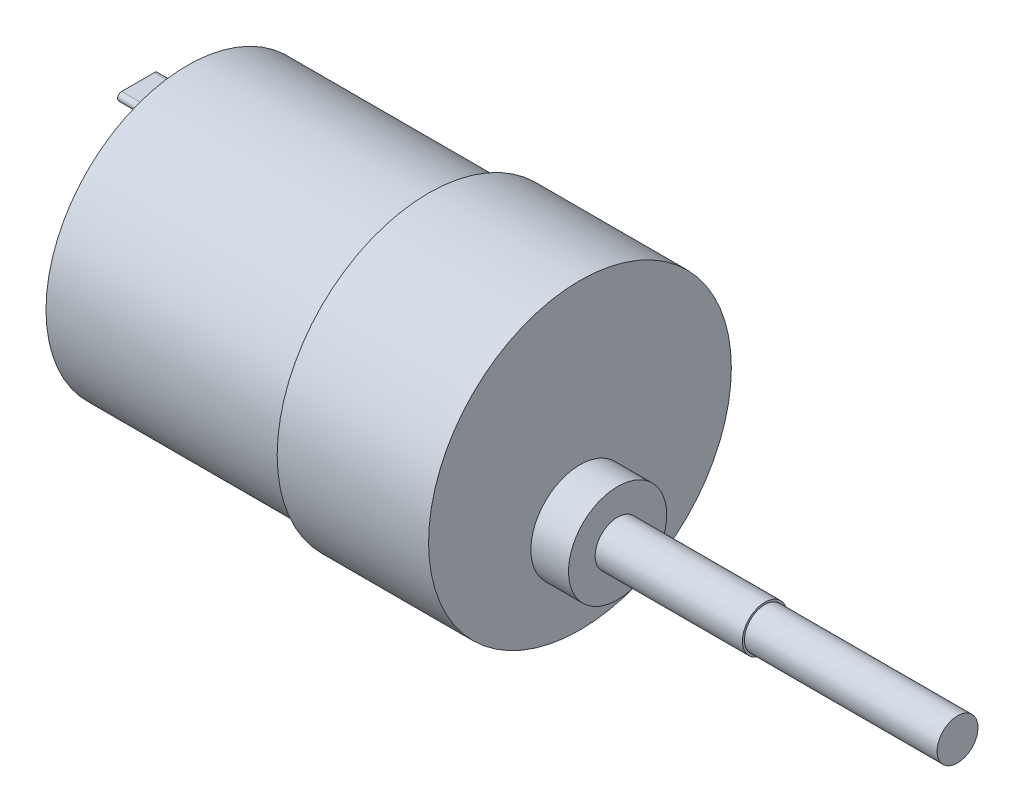
from build123d import *

# Parameters (mm, degrees)
SKETCH1_R           = 17.25
BOSS_EXTRUDE1_DEPTH = 29.5
SKETCH2_R           = 18.5
BOSS_EXTRUDE2_DEPTH = 18.5
SKETCH3_R           = 3
BOSS_EXTRUDE3_DEPTH = 1.5
SKETCH4_R           = 1.5
BOSS_EXTRUDE4_DEPTH = 1.5
BOSS_EXTRUDE5_DEPTH = 6
SKETCH7_R           = 6
BOSS_EXTRUDE6_DEPTH = 4.6
SKETCH8_R           = 2.75
BOSS_EXTRUDE7_DEPTH = 18
SKETCH9_R           = 2.5
BOSS_EXTRUDE8_DEPTH = 23.54


with BuildPart() as part:
    # Sketch1 → Boss-Extrude1 (new body)
    with BuildSketch(Plane(origin=(0, 0, 0), x_dir=(0, 0, -1), z_dir=(1, 0, 0))):
        Circle(SKETCH1_R)
    extrude(amount=BOSS_EXTRUDE1_DEPTH)

    # Sketch2 → Boss-Extrude2 (add)
    with BuildSketch(Plane(origin=(29.5, 0, 0), x_dir=(0, 0, -1), z_dir=(1, 0, 0))):
        Circle(SKETCH2_R)
    extrude(amount=BOSS_EXTRUDE2_DEPTH)

    # Sketch3 → Boss-Extrude3 (add)
    with BuildSketch(Plane.ZY):
        Circle(SKETCH3_R)
    extrude(amount=BOSS_EXTRUDE3_DEPTH)

    # Sketch4 → Boss-Extrude4 (add)
    with BuildSketch(Plane.ZY.offset(1.5)):
        Circle(SKETCH4_R)
    extrude(amount=BOSS_EXTRUDE4_DEPTH)

    # Sketch5 → Boss-Extrude5 (add)
    with BuildSketch(Plane.ZY):
        with BuildLine():
            Line((-2, 12.5), (2, 12.5))
            ThreePointArc((2, 12.5), (2.5, 12), (2, 11.5))
            Line((2, 11.5), (-2, 11.5))
            ThreePointArc((-2, 11.5), (-2.5, 12), (-2, 12.5))
        make_face()
        with BuildLine():
            Line((-2, -12.5), (2, -12.5))
            ThreePointArc((2, -12.5), (2.5, -12), (2, -11.5))
            Line((2, -11.5), (-2, -11.5))
            ThreePointArc((-2, -11.5), (-2.5, -12), (-2, -12.5))
        make_face()
    extrude(amount=BOSS_EXTRUDE5_DEPTH)

    # Sketch7 → Boss-Extrude6 (add)
    with BuildSketch(Plane(origin=(48, 0, 0), x_dir=(0, 0, -1), z_dir=(1, 0, 0))):
        with Locations((0, -7)):
            Circle(SKETCH7_R)
    extrude(amount=BOSS_EXTRUDE6_DEPTH)

    # Sketch8 → Boss-Extrude7 (add)
    with BuildSketch(Plane(origin=(52.6, 0, 0), x_dir=(0, 0, -1), z_dir=(1, 0, 0))):
        with Locations((0, -7)):
            Circle(SKETCH8_R)
    extrude(amount=BOSS_EXTRUDE7_DEPTH)

    # Sketch9 → Boss-Extrude8 (add)
    with BuildSketch(Plane(origin=(70.6, 0, 0), x_dir=(0, 0, -1), z_dir=(1, 0, 0))):
        with Locations((0, -7)):
            Circle(SKETCH9_R)
    extrude(amount=BOSS_EXTRUDE8_DEPTH)


solid = part.part
